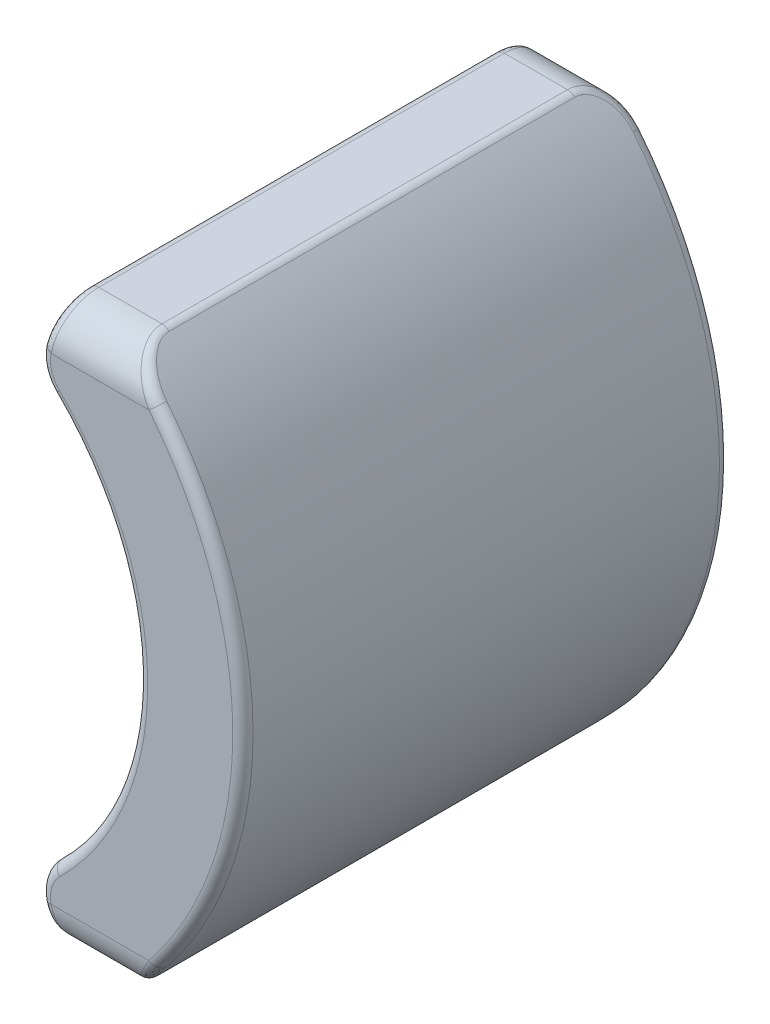
from build123d import *

# Parameters (mm, degrees)
BOSS_EXTRUDE1_DEPTH = 12
FILLET1_R           = 1
FILLET2_R           = 1
FILLET3_R           = 0.25
SCALE1_SCALE        = 0.445


with BuildPart() as part:
    # Sketch1 → Boss-Extrude1 (new body)
    with BuildSketch(Plane.XY):
        with BuildLine():
            Line((6.738137725, -6.88), (4.878137725, -6.88))
            Line((4.878137725, -6.88), (4.531835438, -5.38))
            ThreePointArc((4.531835438, -5.38), (7.034339517, 0), (4.531835438, 5.38))
            Line((4.531835438, 5.38), (4.878137725, 6.88))
            Line((4.878137725, 6.88), (6.738137725, 6.88))
            ThreePointArc((6.738137725, 6.88), (9.63, 0), (6.738137725, -6.88))
        make_face()
    extrude(amount=BOSS_EXTRUDE1_DEPTH)

    # Fillet1
    fillet1_edges = [part.edges().sort_by_distance(p)[0] for p in [
        (4.531835438, -5.38, 6),
        (4.531835438, 5.38, 6),
    ]]
    fillet(fillet1_edges, radius=FILLET1_R)

    # Fillet2
    fillet2_edges = [part.edges().sort_by_distance(p)[0] for p in [
        (5.808137725, -6.88, 0),
        (5.808137725, -6.88, 12),
        (5.808137725, 6.88, 0),
        (5.808137725, 6.88, 12),
    ]]
    fillet(fillet2_edges, radius=FILLET2_R)

    # Fillet3
    fillet3_edges = [part.edges().sort_by_distance(p)[0] for p in [
        (7.034339517, 0, 0),
        (4.687877266, 5.411310183, 0),
        (7.034339517, 0, 12),
        (4.687877266, -5.411310183, 12),
        (6.738137725, -6.88, 6),
        (4.878137725, -6.88, 6),
        (9.63, 0, 0),
        (6.738137725, 6.88, 6),
        (9.63, 0, 12),
        (7.064336577, 6.544619807, 11.7471817),
        (7.064336577, 6.544619807, 0.2528183),
        (7.064336589, -6.544619821, 11.747181705),
        (7.064336577, -6.544619807, 0.2528183),
        (4.687877266, -5.411310183, 0),
        (4.655934772, -5.914769545, 11.999395357),
        (4.655934772, -5.914769545, 0.000604643),
        (4.815123489, -6.607055355, 11.686578845),
        (4.815123489, -6.607055355, 0.313421155),
        (4.687877266, 5.411310183, 12),
        (4.878137725, 6.88, 6),
        (4.815123489, 6.607055355, 11.686578845),
        (4.815123489, 6.607055355, 0.313421155),
        (4.655934776, 5.914769544, 11.99939535),
        (4.655934776, 5.914769544, 0.00060465),
    ]]
    fillet(fillet3_edges, radius=FILLET3_R)


with BuildPart() as part_1:
    # Scale1: scaled about (0, 0, 0)
    add(part.part.scale(SCALE1_SCALE))


solid = part_1.part
